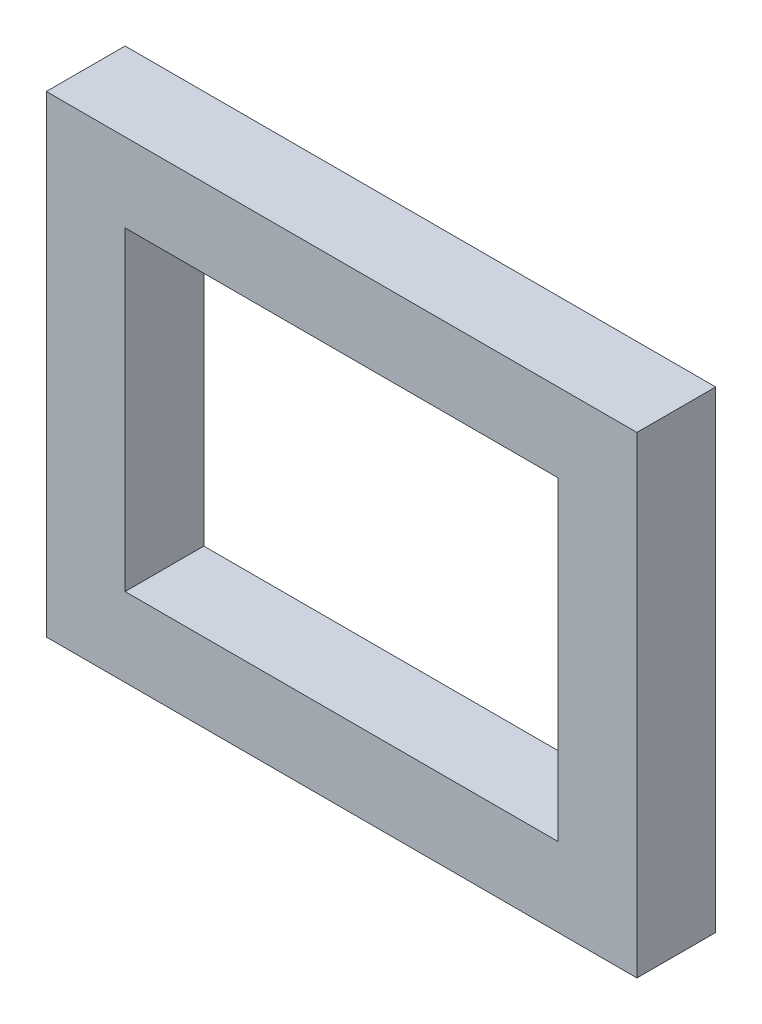
from build123d import *

# Parameters (mm, degrees)
SKETCH1_W           = 75
SKETCH1_H           = 60
SKETCH1_W_2         = 55
SKETCH1_H_2         = 40
BOSS_EXTRUDE1_DEPTH = 10


with BuildPart() as part:
    # Sketch1 → Boss-Extrude1 (new body)
    with BuildSketch(Plane.XY):
        Rectangle(SKETCH1_W, SKETCH1_H)
        Rectangle(SKETCH1_W_2, SKETCH1_H_2, mode=Mode.SUBTRACT)
    extrude(amount=BOSS_EXTRUDE1_DEPTH)


solid = part.part
